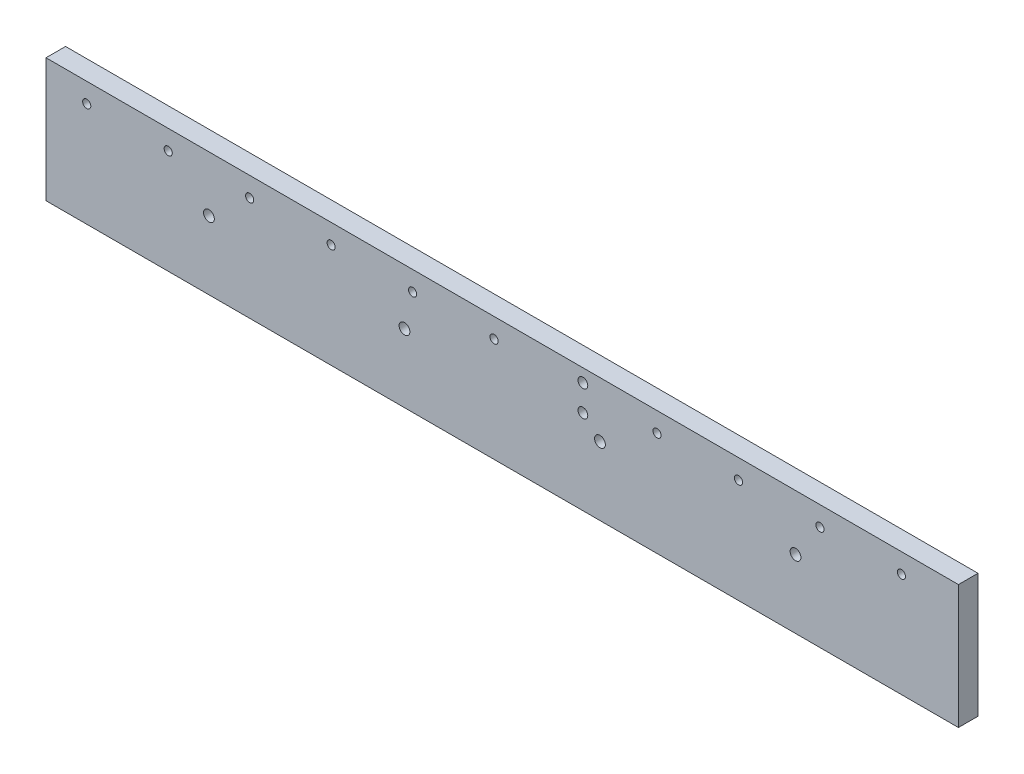
from build123d import *

# Parameters (mm, degrees)
ESQUISSE1_W                  = 280
ESQUISSE1_H                  = 38
BOSS_EXTRU_1_DEPTH           = 6
ESQUISSE2_R                  = 1.25
ENL_V_MAT_EXTRU_1_DEPTH      = 6
ESQUISSE5_R                  = 1.25
BOSS_EXTRU_2_DEPTH           = 6
ENL_V_MAT_EXTRU_2_DEPTH      = 283.630500831
ENL_V_MAT_EXTRU_2_DEPTH_BACK = 283.630500831
ESQUISSE3_R                  = 1.65
ENL_V_MAT_EXTRU_3_DEPTH      = 283.630500831
ENL_V_MAT_EXTRU_3_DEPTH_BACK = 283.630500831
ESQUISSE4_R                  = 1.5


with BuildPart() as part:
    # Esquisse1 → Boss.-Extru.1 (new body)
    with BuildSketch(Plane.XY):
        with Locations((140, 19)):
            Rectangle(ESQUISSE1_W, ESQUISSE1_H)
    extrude(amount=BOSS_EXTRU_1_DEPTH)

    # Esquisse2 → Enlèv. mat.-Extru.1 (cut)
    with BuildSketch(Plane.XY.offset(6)):
        with Locations((12.5, 32)):
            Circle(ESQUISSE2_R)
        with Locations((37.5, 32)):
            Circle(ESQUISSE2_R)
        with Locations((62.5, 32)):
            Circle(ESQUISSE2_R)
        with Locations((87.5, 32)):
            Circle(ESQUISSE2_R)
        with Locations((112.5, 32)):
            Circle(ESQUISSE2_R)
        with Locations((137.5, 32)):
            Circle(ESQUISSE2_R)
        with Locations((162.5, 32)):
            Circle(ESQUISSE2_R)
        with Locations((187.5, 32)):
            Circle(ESQUISSE2_R)
        with Locations((212.5, 32)):
            Circle(ESQUISSE2_R)
        with Locations((237.5, 32)):
            Circle(ESQUISSE2_R)
        with Locations((262.5, 32)):
            Circle(ESQUISSE2_R)
    extrude(amount=-ENL_V_MAT_EXTRU_1_DEPTH, mode=Mode.SUBTRACT)

    # Esquisse5 → Boss.-Extru.2 (add)
    with BuildSketch(Plane.XY.offset(6)):
        with Locations((162.5, 32)):
            Circle(ESQUISSE5_R)
    extrude(amount=-BOSS_EXTRU_2_DEPTH)

    # Esquisse3 → Enlèv. mat.-Extru.2 (cut, two sides: drawn at the far end of the back side and taken through both)
    with BuildSketch(Plane.XY.offset(6).offset(-ENL_V_MAT_EXTRU_2_DEPTH_BACK)):
        with Locations((50, 21)):
            Circle(ESQUISSE3_R)
        with Locations((110, 21)):
            Circle(ESQUISSE3_R)
        with Locations((170, 21)):
            Circle(ESQUISSE3_R)
        with Locations((230, 21)):
            Circle(ESQUISSE3_R)
    extrude(amount=ENL_V_MAT_EXTRU_2_DEPTH + ENL_V_MAT_EXTRU_2_DEPTH_BACK, mode=Mode.SUBTRACT)

    # Esquisse4 → Enlèv. mat.-Extru.3 (cut, two sides: drawn at the far end of the back side and taken through both)
    with BuildSketch(Plane.XY.offset(6).offset(-ENL_V_MAT_EXTRU_3_DEPTH_BACK)):
        with Locations((164.75, 34)):
            Circle(ESQUISSE4_R)
        with Locations((164.75, 26)):
            Circle(ESQUISSE4_R)
    extrude(amount=ENL_V_MAT_EXTRU_3_DEPTH + ENL_V_MAT_EXTRU_3_DEPTH_BACK, mode=Mode.SUBTRACT)


solid = part.part
